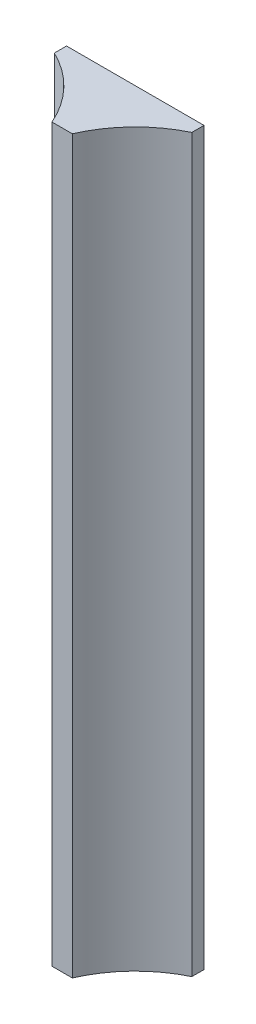
from build123d import *

# Parameters (mm, degrees)
BOSS_EXTRUDE1_DEPTH = 60


with BuildPart() as part:
    # Sketch1 → Boss-Extrude1 (new body)
    with BuildSketch(Plane(origin=(0, 0, 0), x_dir=(1, 0, 0), z_dir=(0, 1, 0))):
        with BuildLine():
            Line((-0.83484861, 0), (0.83484861, 0))
            ThreePointArc((0.83484861, 0), (2.790632181, 2.930008344), (5.641101056, 5))
            Line((5.641101056, 5), (5.641101056, 6))
            Line((5.641101056, 6), (-5.641101056, 6))
            Line((-5.641101056, 6), (-5.641101056, 5))
            ThreePointArc((-5.641101056, 5), (-2.790632181, 2.930008344), (-0.83484861, 0))
        make_face()
    extrude(amount=BOSS_EXTRUDE1_DEPTH)


solid = part.part
